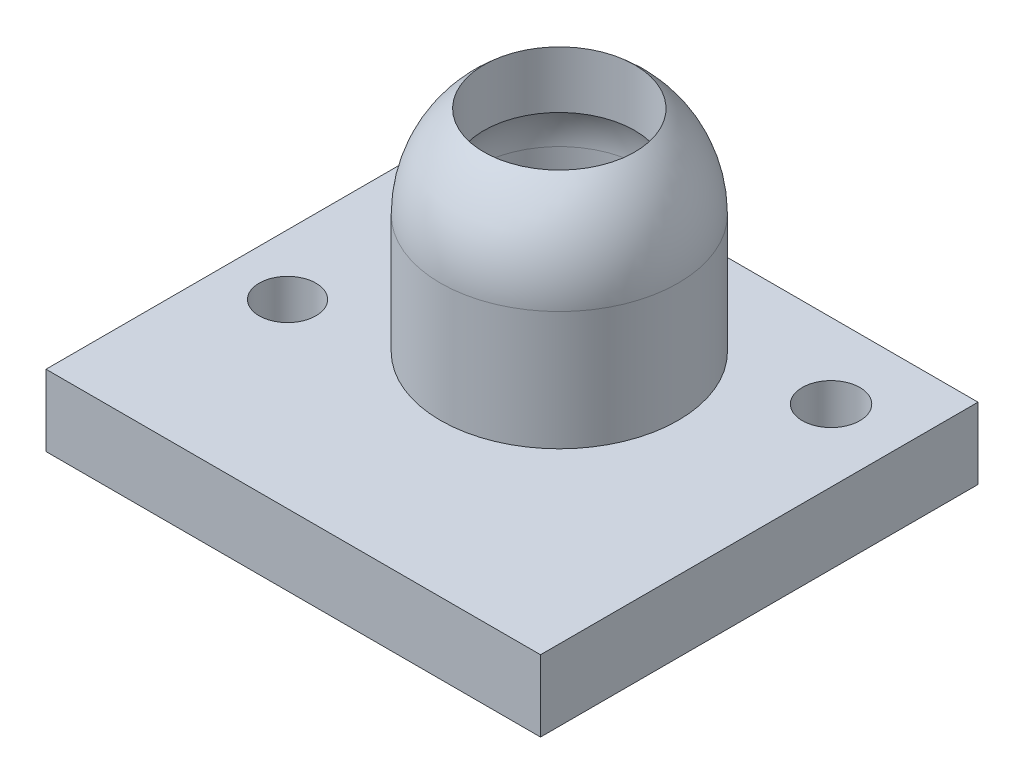
from build123d import *

# Parameters (mm, degrees)
REVOLVE1_ANGLE             = 180
SKETCH3_R                  = 5
SKETCH3_R_2                = 3.5
BOSS_EXTRUDE1_DEPTH        = 5
F_1_4_0_2500_DOWEL_HOLE2_D = 6.35
SKETCH8_W                  = 20.8
SKETCH8_H                  = 18.4
SKETCH8_R                  = 3.5
BOSS_EXTRUDE3_DEPTH        = 3
CUT_EXTRUDE1_DEPTH         = 101.130363876
SKETCH11_R                 = 4
BOSS_EXTRUDE4_DEPTH        = 2
SKETCH12_R                 = 1.25
CUT_EXTRUDE2_DEPTH         = 5
CUT_EXTRUDE4_START         = -0.75
SKETCH13_R                 = 3.5
SKETCH13_R_2               = 2.05
CUT_EXTRUDE4_DEPTH         = 0.75


with BuildPart() as part:
    # Sketch2 → Revolve1 (revolve)
    with BuildSketch(Plane(origin=(0, 0, 0), x_dir=(1, 0, 0), z_dir=(0, 1, 0))):
        with BuildLine():
            Line((76.085159762, 34.800683112), (74.585159762, 34.800683112))
            ThreePointArc((74.585159762, 34.800683112), (79.585159762, 39.800683112), (84.585159762, 34.800683112))
            Line((84.585159762, 34.800683112), (83.085159762, 34.800683112))
            ThreePointArc((83.085159762, 34.800683112), (79.585159762, 38.300683112), (76.085159762, 34.800683112))
        make_face()
    revolve(axis=Axis((79.585159762, 0, -34.800683112), (1, 0, 0)), revolution_arc=REVOLVE1_ANGLE)

    # Sketch3 → Boss-Extrude1 (add)
    with BuildSketch(Plane.XZ):
        with Locations(Location((79.585159762, -34.800683112, 0), (0, 0, 270))):
            Circle(SKETCH3_R)
        with Locations(Location((79.585159762, -34.800683112, 0), (0, 0, 270))):
            Circle(SKETCH3_R_2, mode=Mode.SUBTRACT)
    extrude(amount=BOSS_EXTRUDE1_DEPTH)

    # 1/4 (0.2500) Dowel Hole2 (through all)
    with Locations(Plane(origin=(79.585159762, -5, -34.800683112), x_dir=(0, 0, -1), z_dir=(0, -1, 0))):
        with Locations((0, 0)):
            Hole(F_1_4_0_2500_DOWEL_HOLE2_D / 2)

    # Sketch8 → Boss-Extrude3 (add)
    with BuildSketch(Plane(origin=(0, -5, 0), x_dir=(-1, 0, 0), z_dir=(0, -1, 0))):
        with Locations((-79.825159762, 32.570683112)):
            Rectangle(SKETCH8_W, SKETCH8_H)
        with Locations((-79.585159762, 34.800683112)):
            Circle(SKETCH8_R, mode=Mode.SUBTRACT)
    extrude(amount=BOSS_EXTRUDE3_DEPTH)

    # Sketch10 → Cut-Extrude1 (cut, through all)
    with BuildSketch(Plane(origin=(0, -8, 0), x_dir=(-1, 0, 0), z_dir=(0, -1, 0))):
        with BuildLine():
            ThreePointArc((-85.993577992, 38.610683112), (-88.061877446, 39.467400797), (-87.205159762, 37.399101343))
            Line((-87.205159762, 37.399101343), (-87.205159762, 38.610683112))
            Line((-87.205159762, 38.610683112), (-85.993577992, 38.610683112))
        make_face()
        with BuildLine():
            Line((-87.205159762, 38.610683112), (-87.205159762, 37.399101343))
            ThreePointArc((-87.205159762, 37.399101343), (-86.348442077, 37.753965427), (-85.993577992, 38.610683112))
            Line((-85.993577992, 38.610683112), (-87.205159762, 38.610683112))
        make_face()
        with BuildLine():
            ThreePointArc((-70.771962331, 30.990683112), (-72.808877756, 31.834401106), (-71.965159762, 29.797485681))
            Line((-71.965159762, 29.797485681), (-71.965159762, 30.990683112))
            Line((-71.965159762, 30.990683112), (-70.771962331, 30.990683112))
        make_face()
        with BuildLine():
            Line((-71.965159762, 30.990683112), (-71.965159762, 29.797485681))
            ThreePointArc((-71.965159762, 29.797485681), (-71.121441767, 30.146965118), (-70.771962331, 30.990683112))
            Line((-70.771962331, 30.990683112), (-71.965159762, 30.990683112))
        make_face()
    extrude(amount=-CUT_EXTRUDE1_DEPTH, mode=Mode.SUBTRACT)

    # Sketch11 → Boss-Extrude4 (add)
    with BuildSketch(Plane(origin=(0, -8, 0), x_dir=(-1, 0, 0), z_dir=(0, -1, 0))):
        with Locations(Location((-79.585159762, 34.800683112, 0), (0, 0, 90))):
            Circle(SKETCH11_R)
    extrude(amount=BOSS_EXTRUDE4_DEPTH)

    # Sketch12 → Cut-Extrude2 (cut)
    with BuildSketch(Plane(origin=(0, -10, 0), x_dir=(-1, 0, 0), z_dir=(0, -1, 0))):
        with Locations(Location((-79.585159762, 34.800683112, 0), (0, 0, 90))):
            Circle(SKETCH12_R)
    extrude(amount=-CUT_EXTRUDE2_DEPTH, mode=Mode.SUBTRACT)

    # Sketch13 → Cut-Extrude4 (cut)
    with BuildSketch(Plane(origin=(0, -10, 0), x_dir=(-1, 0, 0), z_dir=(0, -1, 0)).offset(CUT_EXTRUDE4_START)):
        with Locations(Location((-79.585159762, 34.800683112, 0), (0, 0, 90))):
            Circle(SKETCH13_R)
        with Locations(Location((-79.585159762, 34.800683112, 0), (0, 0, 90))):
            Circle(SKETCH13_R_2, mode=Mode.SUBTRACT)
    extrude(amount=CUT_EXTRUDE4_DEPTH, mode=Mode.SUBTRACT)


solid = part.part
